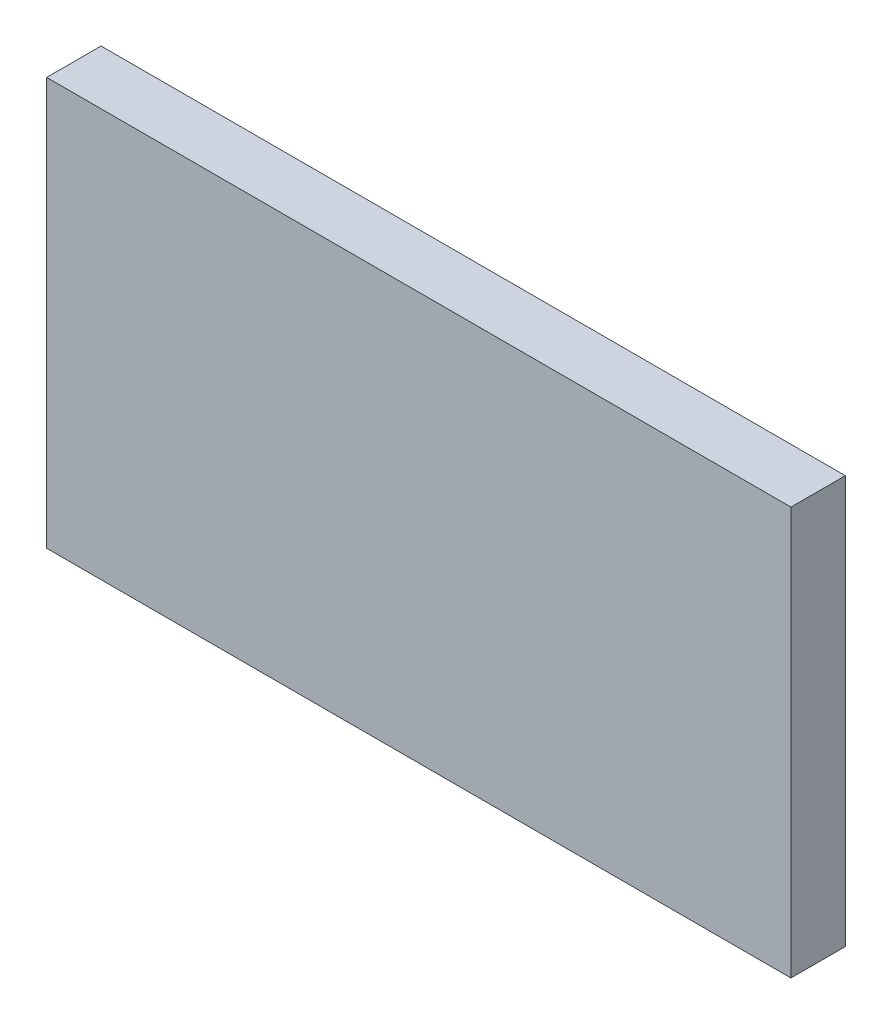
from build123d import *

# Parameters (mm, degrees)
CURVESKETCH_W   = 31.719
CURVESKETCH_H   = 17.381
CURVEBOSS_DEPTH = 2.317


with BuildPart() as part:
    # CurveSketch → CurveBoss (new body)
    with BuildSketch(Plane.XY):
        with Locations((-4.193, 6.827)):
            Rectangle(CURVESKETCH_W, CURVESKETCH_H)
    extrude(amount=CURVEBOSS_DEPTH)


solid = part.part
